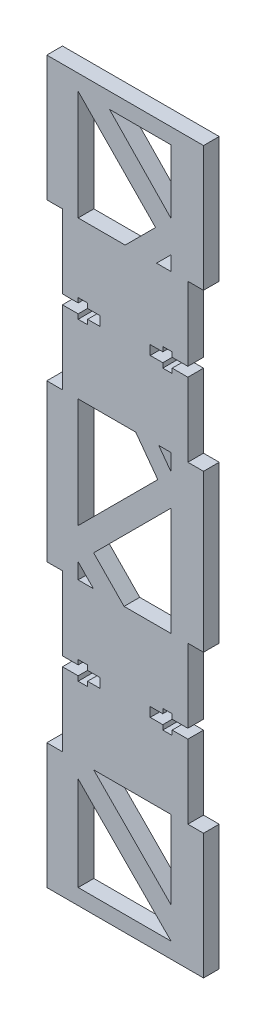
from build123d import *

# Parameters (mm, degrees)
SKETCH1_W           = 50
SKETCH1_H           = 230
BOSS_EXTRUDE1_DEPTH = 5
SKETCH9_W           = 5
SKETCH9_H           = 50
CUT_EXTRUDE6_DEPTH  = 7
SKETCH10_R          = 1.5
CUT_EXTRUDE7_DEPTH  = 7
CUT_EXTRUDE8_START  = -7
SKETCH11_R          = 1.5
CUT_EXTRUDE8_DEPTH  = 7
CUT_EXTRUDE9_DEPTH  = 7
SKETCH13_W          = 40
SKETCH13_H          = 50
BOSS_EXTRUDE2_DEPTH = 5
CUT_EXTRUDE10_DEPTH = 5


with BuildPart() as part:
    # Sketch1 → Boss-Extrude1 (new body)
    with BuildSketch(Plane.XY):
        Rectangle(SKETCH1_W, SKETCH1_H)
    extrude(amount=BOSS_EXTRUDE1_DEPTH)

    # Sketch9 → Cut-Extrude6 (cut)
    with BuildSketch(Plane.XY.offset(5)):
        with Locations((-22.5, 50)):
            Rectangle(SKETCH9_W, SKETCH9_H)
        with Locations((-22.5, -50)):
            Rectangle(SKETCH9_W, SKETCH9_H)
        with Locations((22.5, -50)):
            Rectangle(SKETCH9_W, SKETCH9_H)
        with Locations((22.5, 50)):
            Rectangle(SKETCH9_W, SKETCH9_H)
    extrude(amount=-CUT_EXTRUDE6_DEPTH, mode=Mode.SUBTRACT)

    # Sketch10 → Cut-Extrude7 (cut)
    with BuildSketch(Plane.ZY.offset(20)):
        with Locations(Location((2.5, 50, 0), (0, 0, 270))):
            Circle(SKETCH10_R)
        with Locations(Location((2.5, -50, 0), (0, 0, 270))):
            Circle(SKETCH10_R)
    extrude(amount=-CUT_EXTRUDE7_DEPTH, mode=Mode.SUBTRACT)

    # Sketch11 → Cut-Extrude8 (cut)
    with BuildSketch(Plane(origin=(20, 0, 0), x_dir=(0, 0, -1), z_dir=(1, 0, 0)).offset(CUT_EXTRUDE8_START)):
        with Locations(Location((-2.5, -50, 0), (0, 0, 270))):
            Circle(SKETCH11_R)
        with Locations(Location((-2.5, 50, 0), (0, 0, 270))):
            Circle(SKETCH11_R)
    extrude(amount=CUT_EXTRUDE8_DEPTH, mode=Mode.SUBTRACT)

    # Sketch12 → Cut-Extrude9 (cut)
    with BuildSketch(Plane.XY.offset(5)):
        Polygon((9.705882353, 84.705882353), (-15, 110), (-15, 60), align=None)
        Polygon((14.647058824, 19.647058824), (14.647058824, 79.647058824), (-10.764705882, 54.235294118), align=None)
        Polygon((10.411764706, 15.411764706), (-15, 50), (-15, -10), align=None)
        Polygon((14.647058824, 110), (-5, 110), (14.647058824, 89.647058824), align=None)
        Polygon((14.647058824, -40.352941176), (14.647058824, 9.647058824), (-10.058823529, -15.058823529), align=None)
        Polygon((9.705882353, -45.294117647), (-15, -20), (-15, -70), align=None)
        Polygon((14.647058824, -100), (14.647058824, -50.352941176), (-10.029585799, -75.029585799), align=None)
        Polygon((14.647058824, -110), (-15, -80), (-15, -110), align=None)
    extrude(amount=-CUT_EXTRUDE9_DEPTH, mode=Mode.SUBTRACT)

    # Sketch13 → Boss-Extrude2 (add)
    with BuildSketch(Plane.XY.offset(5)):
        with Locations((0, -50)):
            Rectangle(SKETCH13_W, SKETCH13_H)
        with Locations((0, 50)):
            Rectangle(SKETCH13_W, SKETCH13_H)
    extrude(amount=-BOSS_EXTRUDE2_DEPTH)

    # Sketch14 → Cut-Extrude10 (cut)
    with BuildSketch(Plane.XY.offset(5)):
        Polygon((-15, -48.5), (-15, -47), (-12, -47), (-12, -48.5), (-8, -48.5), (-8, -51.5), (-12, -51.5), (-12, -53), (-15, -53), (-15, -51.5), (-20, -51.5), (-20, -48.5), align=None)
        Polygon((-20, 48.5), (-15, 48.5), (-15, 47), (-12, 47), (-12, 48.5), (-8, 48.5), (-8, 51.5), (-12, 51.5), (-12, 53), (-15, 53), (-15, 51.5), (-20, 51.5), align=None)
        Polygon((15, -48.5), (15, -47), (12, -47), (12, -48.5), (8, -48.5), (8, -51.5), (12, -51.5), (12, -53), (15, -53), (15, -51.5), (20, -51.5), (20, -48.5), align=None)
        Polygon((20, 48.5), (15, 48.5), (15, 47), (12, 47), (12, 48.5), (8, 48.5), (8, 51.5), (12, 51.5), (12, 53), (15, 53), (15, 51.5), (20, 51.5), align=None)
    extrude(amount=-CUT_EXTRUDE10_DEPTH, mode=Mode.SUBTRACT)


solid = part.part
